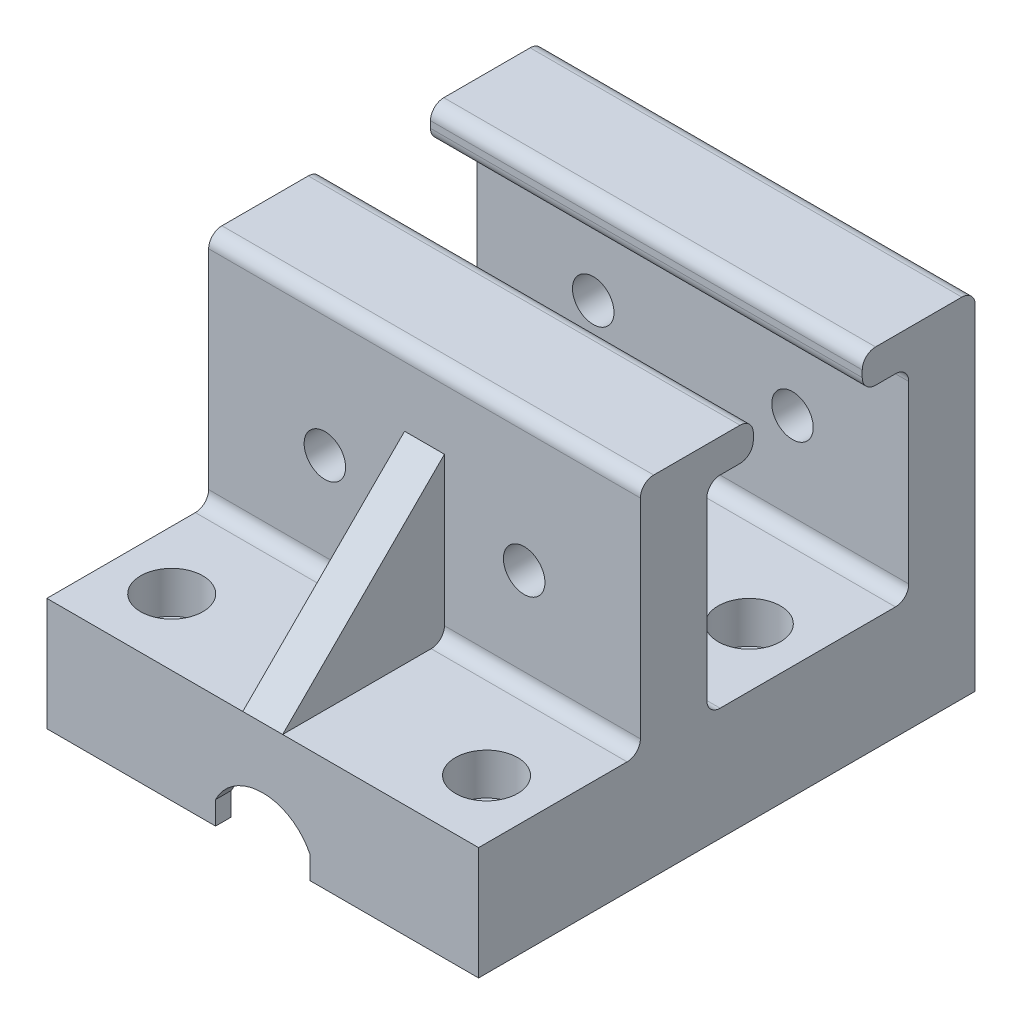
from build123d import *

# Parameters (mm, degrees)
BOSS_EXTRUDE1_DEPTH             = 94.9452
SKETCH2_R                       = 18.923
CUT_EXTRUDE1_DEPTH              = 56.9976
BOSS_EXTRUDE2_START             = -2.9972
BOSS_EXTRUDE2_DEPTH             = 2.9972
BOSS_EXTRUDE3_REACH             = 107.756
BOSS_EXTRUDE3_DIRECTION_2_REACH = 107.756
HOLE2_D                         = 7.9375
HOLE2_CBORE_D                   = 11.90625
HOLE2_CBORE_DEPTH               = 7.9375
CUT_EXTRUDE3_DEPTH              = 124.072551497
CUT_EXTRUDE3_DEPTH_BACK         = 124.072551497
SKETCH10_R                      = 3.96875
RIB1_REACH                      = 125.073
SKETCH11_WALL_W                 = 291.896910816
SKETCH11_WALL_H                 = 7.62
FILLET1_R                       = 2.54


with BuildPart() as part:
    # Sketch1 → Boss-Extrude1 (new body)
    with BuildSketch(Plane.XY):
        with BuildLine():
            Line((15.875, 0), (41.275, 0))
            Line((41.275, 0), (41.275, 21.59))
            Line((41.275, 21.59), (-41.275, 21.59))
            Line((-41.275, 21.59), (-41.275, 0))
            Line((-41.275, 0), (-15.875, 0))
            ThreePointArc((-15.875, 0), (0, 15.875), (15.875, 0))
        make_face()
    extrude(amount=BOSS_EXTRUDE1_DEPTH)

    # Sketch2 → Cut-Extrude1 (cut)
    with BuildSketch(Plane(origin=(0, 0, 0), x_dir=(-1, 0, 0), z_dir=(0, 0, -1))):
        Circle(SKETCH2_R)
    extrude(amount=-CUT_EXTRUDE1_DEPTH, mode=Mode.SUBTRACT)

    # Sketch3 → Boss-Extrude2 (add)
    with BuildSketch(Plane.XY.offset(94.9452).offset(BOSS_EXTRUDE2_START)):
        with BuildLine():
            Line((-9.017, 4.399409051), (-9.017, 0))
            Line((-9.017, 0), (-15.875, 0))
            ThreePointArc((-15.875, 0), (0, 15.875), (15.875, 0))
            Line((15.875, 0), (9.017, 0))
            Line((9.017, 0), (9.017, 4.399409051))
            ThreePointArc((9.017, 4.399409051), (0, 10.033), (-9.017, 4.399409051))
        make_face()
    extrude(amount=BOSS_EXTRUDE2_DEPTH)

    # Boss-Extrude3: up to this face of the body (flat: up to its plane)
    boss_extrude3_end = Plane(part.part.faces().sort_by_distance((41.275, 10.795, 47.4726))[0])
    # Sketch6 → Boss-Extrude3 (add, up to the picked face)
    with BuildSketch(Plane(origin=(0, 0, 0), x_dir=(0, 0, -1), z_dir=(1, 0, 0)), mode=Mode.PRIVATE) as boss_extrude3_sk1:
        Polygon((0, 21.59), (0, 66.548), (-21.59, 66.548), (-21.59, 60.198), (-12.7, 60.198), (-12.7, 21.59), align=None)
    boss_extrude3_tool1 = split(extrude(boss_extrude3_sk1.sketch, amount=BOSS_EXTRUDE3_REACH, mode=Mode.PRIVATE), bisect_by=boss_extrude3_end, keep=Keep.BOTH, mode=Mode.PRIVATE)
    # Sketch6 → Boss-Extrude3 (add, up to the picked face)
    with BuildSketch(Plane(origin=(0, 0, 0), x_dir=(0, 0, -1), z_dir=(1, 0, 0)), mode=Mode.PRIVATE) as boss_extrude3_sk2:
        Polygon((-51.308, 21.59), (-64.008, 21.59), (-64.008, 66.548), (-42.418, 66.548), (-42.418, 60.198), (-51.308, 60.198), align=None)
    boss_extrude3_tool2 = split(extrude(boss_extrude3_sk2.sketch, amount=BOSS_EXTRUDE3_REACH, mode=Mode.PRIVATE), bisect_by=boss_extrude3_end, keep=Keep.BOTH, mode=Mode.PRIVATE)
    add(boss_extrude3_tool1.solids().sort_by(Axis((0, 45.805864, 7.321272), (1, 0, 0)))[0])
    add(boss_extrude3_tool2.solids().sort_by(Axis((0, 45.805864, 56.686728), (1, 0, 0)))[0])

    # Boss-Extrude3 direction 2: up to this face of the body (flat: up to its plane)
    boss_extrude3_direction_2_end = Plane(part.part.faces().sort_by_distance((-41.275, 10.795, 47.4726))[0])
    # Sketch6 → Boss-Extrude3 direction 2 (add, up to the picked face)
    with BuildSketch(Plane(origin=(0, 0, 0), x_dir=(0, 0, -1), z_dir=(1, 0, 0)), mode=Mode.PRIVATE) as boss_extrude3_direction_2_sk1:
        Polygon((0, 21.59), (0, 66.548), (-21.59, 66.548), (-21.59, 60.198), (-12.7, 60.198), (-12.7, 21.59), align=None)
    boss_extrude3_direction_2_tool1 = split(extrude(boss_extrude3_direction_2_sk1.sketch, amount=-BOSS_EXTRUDE3_DIRECTION_2_REACH, mode=Mode.PRIVATE), bisect_by=boss_extrude3_direction_2_end, keep=Keep.BOTH, mode=Mode.PRIVATE)
    # Sketch6 → Boss-Extrude3 direction 2 (add, up to the picked face)
    with BuildSketch(Plane(origin=(0, 0, 0), x_dir=(0, 0, -1), z_dir=(1, 0, 0)), mode=Mode.PRIVATE) as boss_extrude3_direction_2_sk2:
        Polygon((-51.308, 21.59), (-64.008, 21.59), (-64.008, 66.548), (-42.418, 66.548), (-42.418, 60.198), (-51.308, 60.198), align=None)
    boss_extrude3_direction_2_tool2 = split(extrude(boss_extrude3_direction_2_sk2.sketch, amount=-BOSS_EXTRUDE3_DIRECTION_2_REACH, mode=Mode.PRIVATE), bisect_by=boss_extrude3_direction_2_end, keep=Keep.BOTH, mode=Mode.PRIVATE)
    add(boss_extrude3_direction_2_tool1.solids().sort_by(Axis((0, 45.805864, 7.321272), (-1, 0, 0)))[0])
    add(boss_extrude3_direction_2_tool2.solids().sort_by(Axis((0, 45.805864, 56.686728), (-1, 0, 0)))[0])

    # Hole2 (through all)
    with Locations(Plane(origin=(0, 21.59, 0), x_dir=(1, 0, 0), z_dir=(0, 1, 0))):
        with Locations((-30.099, -32.004), (-30.099, -82.2452)):
            hole2 = CounterBoreHole(HOLE2_D / 2, HOLE2_CBORE_D / 2, HOLE2_CBORE_DEPTH)

    # Mirror2: Hole2 across plane
    add(hole2.mirror(Plane(origin=(0, 0, 0), x_dir=(0, 0, 1), z_dir=(1, 0, 0))), mode=Mode.SUBTRACT)

    # Sketch10 → Cut-Extrude3 (cut, two sides: drawn at the far end of the back side and taken through both)
    with BuildSketch(Plane.XY.offset(-CUT_EXTRUDE3_DEPTH_BACK)):
        with Locations((-19.05, 40.894)):
            Circle(SKETCH10_R)
        with Locations((19.05, 40.894)):
            Circle(SKETCH10_R)
    extrude(amount=CUT_EXTRUDE3_DEPTH + CUT_EXTRUDE3_DEPTH_BACK, mode=Mode.SUBTRACT)

    # Sketch11 wall → Rib1 (add, up to next)
    with BuildSketch(Plane(origin=(0, 37.0586, 79.4766), x_dir=(0, 0.707106781187, -0.707106781187), z_dir=(0, 0.707106781187, 0.707106781187)), mode=Mode.PRIVATE) as rib1_sk1:
        Rectangle(SKETCH11_WALL_W, SKETCH11_WALL_H)
    rib1_tool1 = extrude(rib1_sk1.sketch, amount=-RIB1_REACH, mode=Mode.PRIVATE) - part.part
    add(rib1_tool1.solids().sort_by_distance((0, 37.0586, 79.4766))[0])

    # Fillet1
    fillet1_edges = [part.edges().sort_by_distance(p)[0] for p in [
        (-22.5425, 21.59, 64.008),
        (0, 60.198, 12.7),
        (0, 60.198, 21.59),
        (0, 66.548, 21.59),
        (0, 66.548, 0),
        (0, 21.59, 12.7),
        (22.5425, 21.59, 64.008),
        (0, 66.548, 64.008),
        (0, 66.548, 42.418),
        (0, 60.198, 42.418),
        (0, 60.198, 51.308),
        (0, 21.59, 51.308),
    ]]
    fillet(fillet1_edges, radius=FILLET1_R)


solid = part.part
